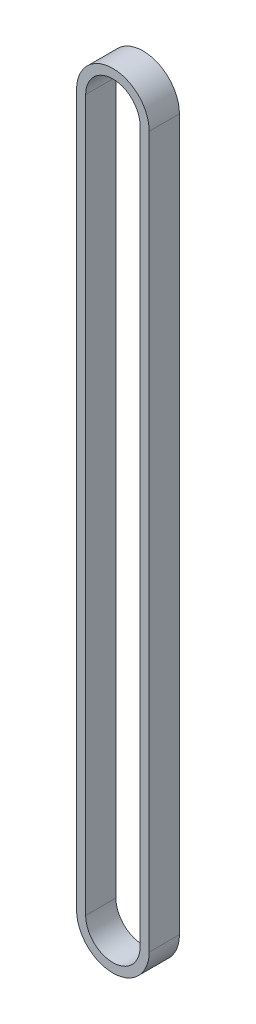
from build123d import *

# Parameters (mm, degrees)
EXTRUDE_1_DEPTH = 10


with BuildPart() as part:
    # 草图1 → 凸台-拉伸1 (new body)
    with BuildSketch(Plane.XY):
        with BuildLine():
            Line((12, 0), (12, -235))
            ThreePointArc((12, -235), (0, -247), (-12, -235))
            Line((-12, -235), (-12, 0))
            ThreePointArc((-12, 0), (0, 12), (12, 0))
        make_face()
        with BuildLine():
            Line((9, 0), (9, -235))
            ThreePointArc((9, -235), (0, -244), (-9, -235))
            Line((-9, -235), (-9, 0))
            ThreePointArc((-9, 0), (0, 9), (9, 0))
        make_face(mode=Mode.SUBTRACT)
    extrude(amount=EXTRUDE_1_DEPTH)


solid = part.part
